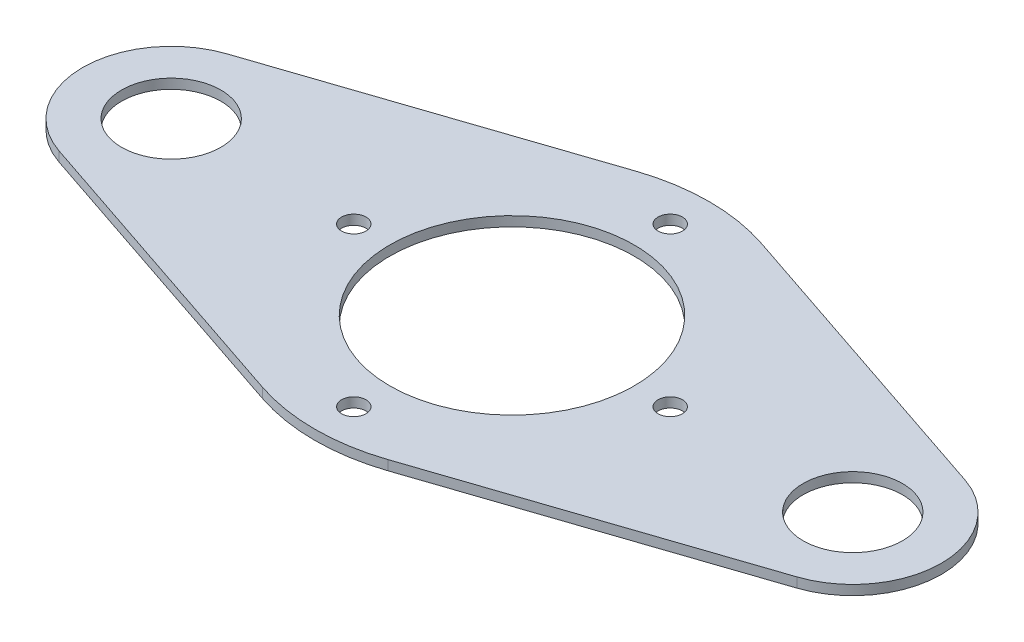
from build123d import *

# Parameters (mm, degrees)
SKETCH1_R           = 3.175
SKETCH1_R_2         = 12.954
SKETCH1_R_3         = 31.877
BOSS_EXTRUDE1_DEPTH = 2.54


with BuildPart() as part:
    # Sketch1 → Boss-Extrude1 (new body)
    with BuildSketch(Plane(origin=(0, 0, 0), x_dir=(1, 0, 0), z_dir=(0, 1, 0))):
        with BuildLine():
            Line((96.26346, 21.909734203), (16.385721429, 48.755177759))
            ThreePointArc((16.385721429, 48.755177759), (0, 51.435), (-16.385721429, 48.755177759))
            Line((-16.385721429, 48.755177759), (-96.26346, 21.909734203))
            ThreePointArc((-96.26346, 21.909734203), (-112.014, 0), (-96.26346, -21.909734203))
            Line((-96.26346, -21.909734203), (-16.385721429, -48.755177759))
            ThreePointArc((-16.385721429, -48.755177759), (0, -51.435), (16.385721429, -48.755177759))
            Line((16.385721429, -48.755177759), (96.26346, -21.909734203))
            ThreePointArc((96.26346, -21.909734203), (112.014, 0), (96.26346, 21.909734203))
        make_face()
        with Locations(Location((-41.275, 0, 0), (0, 0, 270))):
            Circle(SKETCH1_R, mode=Mode.SUBTRACT)
        with Locations(Location((0, -41.275, 0), (0, 0, 270))):
            Circle(SKETCH1_R, mode=Mode.SUBTRACT)
        with Locations(Location((-88.9, 0, 0), (0, 0, 270))):
            Circle(SKETCH1_R_2, mode=Mode.SUBTRACT)
        with Locations(Location((0, 0, 0), (0, 0, 270))):
            Circle(SKETCH1_R_3, mode=Mode.SUBTRACT)
        with Locations(Location((41.275, 0, 0), (0, 0, 270))):
            Circle(SKETCH1_R, mode=Mode.SUBTRACT)
        with Locations(Location((88.9, 0, 0), (0, 0, 270))):
            Circle(SKETCH1_R_2, mode=Mode.SUBTRACT)
        with Locations(Location((0, 41.275, 0), (0, 0, 270))):
            Circle(SKETCH1_R, mode=Mode.SUBTRACT)
    extrude(amount=BOSS_EXTRUDE1_DEPTH)


solid = part.part
